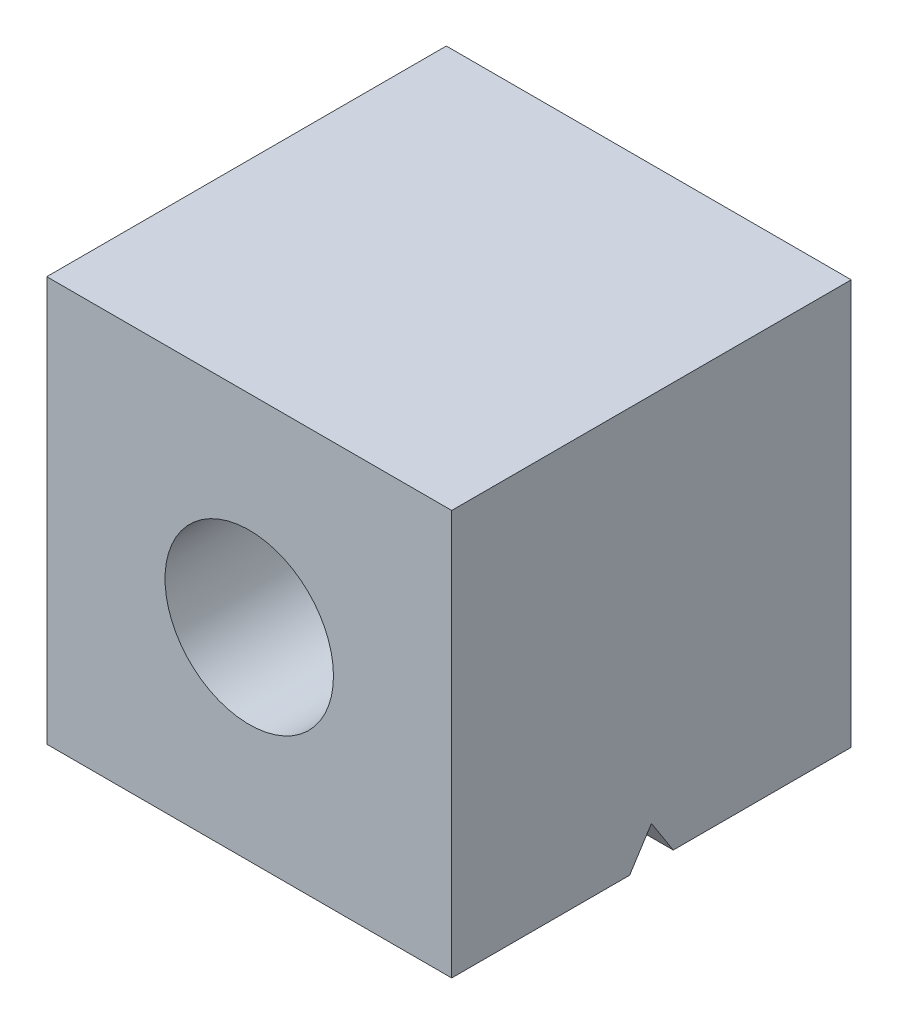
from build123d import *

# Parameters (mm, degrees)
SKETCH1_W               = 19.05
SKETCH1_H               = 19.05
BOSS_EXTRUDE1_DEPTH     = 18.796
SKETCH2_R               = 3.9624
CUT_EXTRUDE1_DEPTH      = 24.124464664
CUT_EXTRUDE2_DEPTH      = 24.124464664
CUT_EXTRUDE2_DEPTH_BACK = 24.124464664


with BuildPart() as part:
    # Sketch1 → Boss-Extrude1 (new body)
    with BuildSketch(Plane.XY):
        Rectangle(SKETCH1_W, SKETCH1_H)
    extrude(amount=BOSS_EXTRUDE1_DEPTH)

    # Sketch2 → Cut-Extrude1 (cut, through all)
    with BuildSketch(Plane.XY.offset(18.796)):
        Circle(SKETCH2_R)
    extrude(amount=-CUT_EXTRUDE1_DEPTH, mode=Mode.SUBTRACT)

    # Sketch3 → Cut-Extrude2 (cut, two sides: drawn at the far end of the back side and taken through both)
    with BuildSketch(Plane(origin=(0, 0, 0), x_dir=(0, 0, -1), z_dir=(1, 0, 0)).offset(-CUT_EXTRUDE2_DEPTH_BACK)):
        Polygon((-39.274452126, -54.498347151), (-10.424511864, -9.525), (-9.398, -7.9248), (-8.371488136, -9.525), (20.478452126, -54.498347151), (20.478452126, -161.361268824), (-39.274452126, -161.361268824), align=None)
    extrude(amount=CUT_EXTRUDE2_DEPTH + CUT_EXTRUDE2_DEPTH_BACK, mode=Mode.SUBTRACT)


solid = part.part
